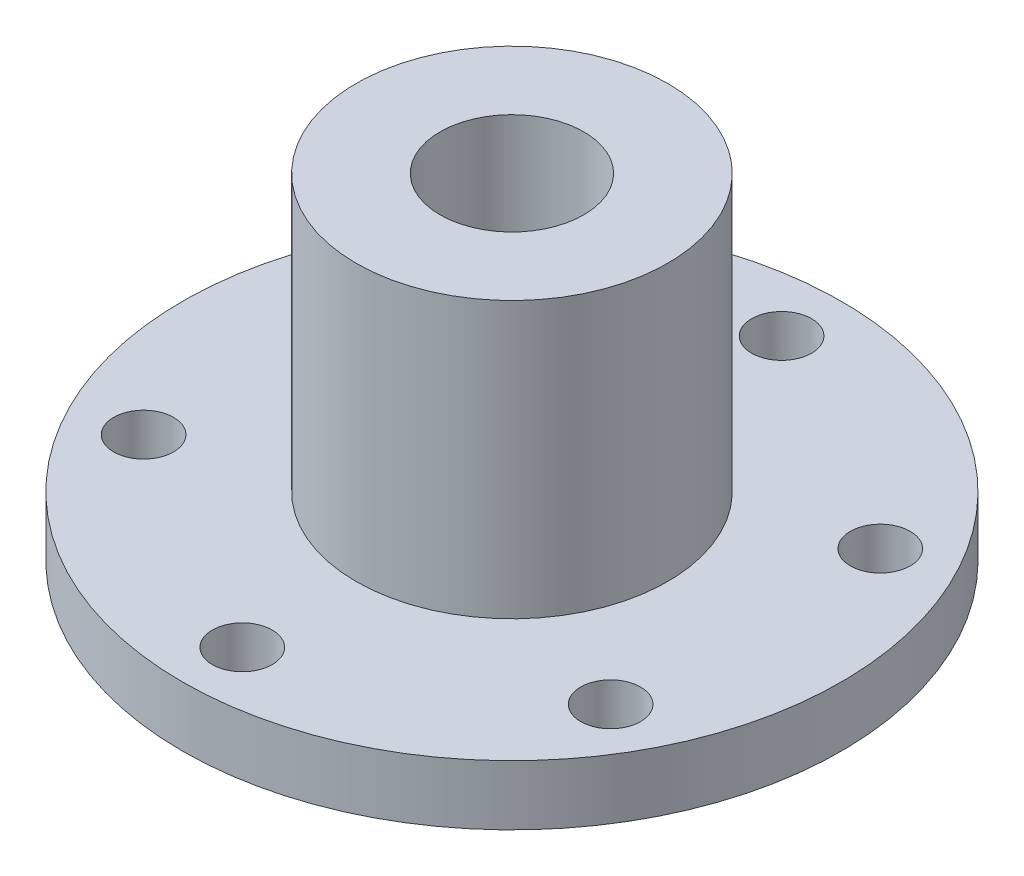
from build123d import *

# Parameters (mm, degrees)
SKETCH_1_R          = 27.5
EXTRUDE_1_DEPTH     = 5
SKETCH_2_R          = 10
EXTRUDE_2_DEPTH     = 3
SKETCH_3_R          = 13
EXTRUDE_3_DEPTH     = 23
SKETCH_4_R          = 6
CUT_EXTRUDE_1_DEPTH = 22
SKETCH_5_R          = 7.75
CUT_EXTRUDE_2_DEPTH = 2
SKETCH_6_R          = 3
CUT_EXTRUDE_3_DEPTH = 49.512884886
SKETCH_7_R          = 2.5
CUT_EXTRUDE_4_DEPTH = 48.921811318


with BuildPart() as part:
    # 草图1 → 凸台-拉伸1 (new body)
    with BuildSketch(Plane(origin=(0, 0, 0), x_dir=(1, 0, 0), z_dir=(0, 1, 0))):
        with Locations(Location((0, 0, 0), (0, 0, 270))):
            Circle(SKETCH_1_R)
    extrude(amount=EXTRUDE_1_DEPTH)

    # 草图2 → 凸台-拉伸2 (add)
    with BuildSketch(Plane.XZ):
        with Locations(Location((0, 0, 0), (0, 0, 270))):
            Circle(SKETCH_2_R)
    extrude(amount=EXTRUDE_2_DEPTH)

    # 草图3 → 凸台-拉伸3 (add)
    with BuildSketch(Plane(origin=(0, 5, 0), x_dir=(1, 0, 0), z_dir=(0, 1, 0))):
        with Locations(Location((0, 0, 0), (0, 0, 270))):
            Circle(SKETCH_3_R)
    extrude(amount=EXTRUDE_3_DEPTH)

    # 草图4 → 切除-拉伸1 (cut)
    with BuildSketch(Plane(origin=(0, 28, 0), x_dir=(1, 0, 0), z_dir=(0, 1, 0))):
        with Locations(Location((0, 0, 0), (0, 0, 270))):
            Circle(SKETCH_4_R)
    extrude(amount=-CUT_EXTRUDE_1_DEPTH, mode=Mode.SUBTRACT)

    # 草图5 → 切除-拉伸2 (cut)
    with BuildSketch(Plane.XZ.offset(3)):
        with Locations(Location((0, 0, 0), (0, 0, 270))):
            Circle(SKETCH_5_R)
    extrude(amount=-CUT_EXTRUDE_2_DEPTH, mode=Mode.SUBTRACT)

    # 草图6 → 切除-拉伸3 (cut, through all)
    with BuildSketch(Plane.XZ.offset(1)):
        with Locations(Location((0, 0, 0), (0, 0, 270))):
            Circle(SKETCH_6_R)
    extrude(amount=-CUT_EXTRUDE_3_DEPTH, mode=Mode.SUBTRACT)

    # 草图7 → 切除-拉伸4 (cut, through all)
    with BuildSketch(Plane.XZ):
        with Locations(Location((0, 22.5, 0), (0, 0, 270))):
            Circle(SKETCH_7_R)
        with Locations(Location((19.485571585, 11.25, 0), (0, 0, 270))):
            Circle(SKETCH_7_R)
        with Locations(Location((19.485571585, -11.25, 0), (0, 0, 270))):
            Circle(SKETCH_7_R)
        with Locations(Location((0, -22.5, 0), (0, 0, 270))):
            Circle(SKETCH_7_R)
        with Locations(Location((-19.485571585, -11.25, 0), (0, 0, 270))):
            Circle(SKETCH_7_R)
        with Locations(Location((-19.485571585, 11.25, 0), (0, 0, 270))):
            Circle(SKETCH_7_R)
    extrude(amount=-CUT_EXTRUDE_4_DEPTH, mode=Mode.SUBTRACT)


solid = part.part
